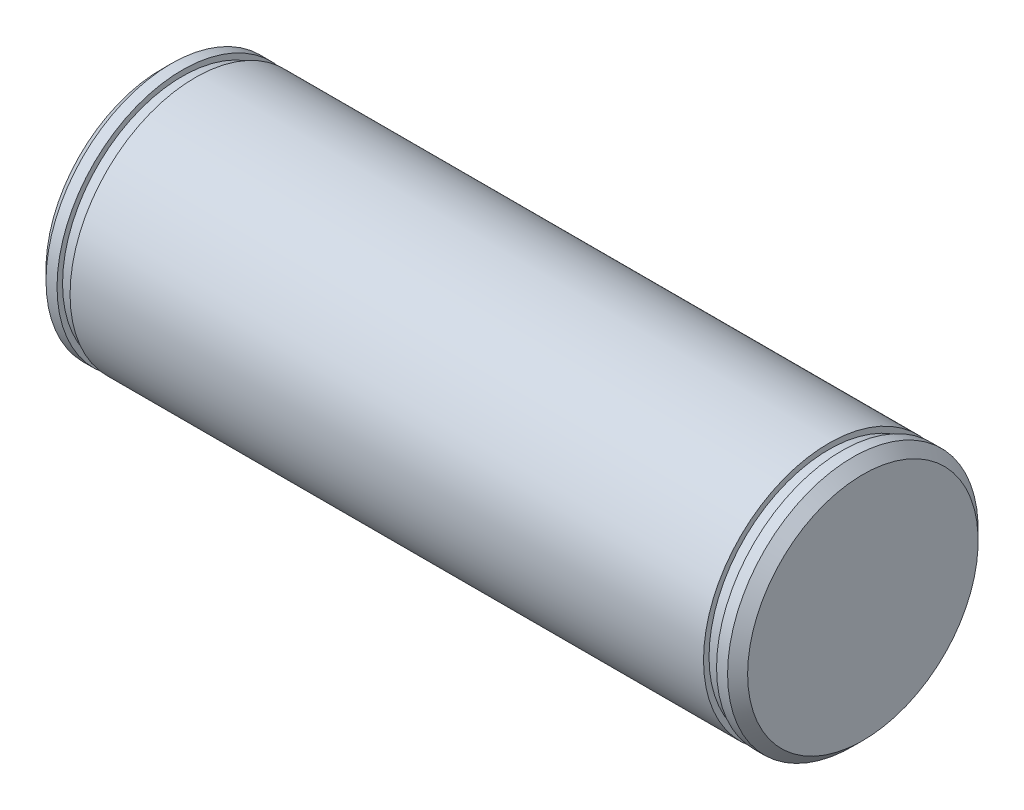
from build123d import *

# Parameters (mm, degrees)
CHAMFER_1_SIZE = 1


with BuildPart() as part:
    # 草图1 → 旋转1 (revolve)
    with BuildSketch(Plane.XY, mode=Mode.PRIVATE) as revolve_1_sk:
        Polygon((0, 0), (0, 12.5), (2.1, 12.5), (2.1, 11.95), (3.4, 11.95), (3.4, 12.5), (66.6, 12.5), (66.6, 11.95), (67.9, 11.95), (67.9, 12.5), (70, 12.5), (70, 0), align=None)
    revolve(revolve_1_sk.sketch.rotate(Axis((0, 0, 0), (1, 0, 0)), 90), axis=Axis((0, 0, 0), (1, 0, 0)))

    # 倒角1
    chamfer_1_edges = [part.edges().sort_by_distance(p)[0] for p in [
        (0, 0, -12.5),
        (70, 0, -12.5),
    ]]
    chamfer(chamfer_1_edges, length=CHAMFER_1_SIZE)


solid = part.part
